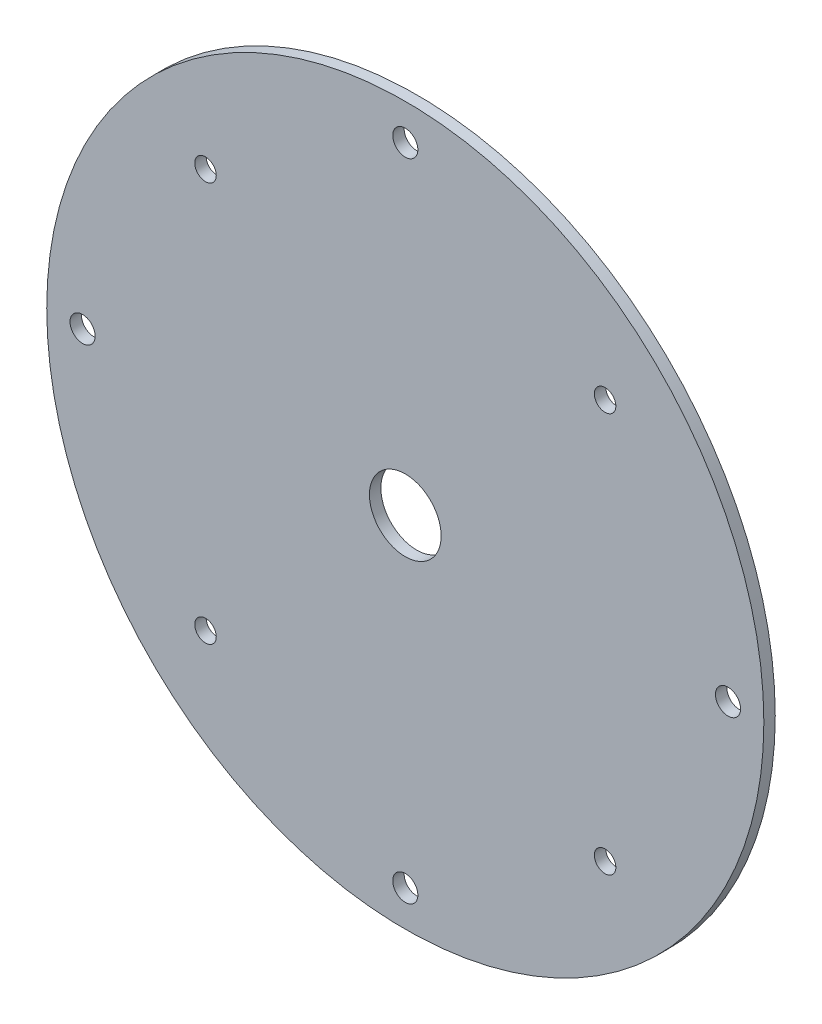
from build123d import *

# Parameters (mm, degrees)
SKETCH1_R           = 50
SKETCH1_R_2         = 5
BOSS_EXTRUDE1_DEPTH = 1.59
SKETCH2_R           = 1.75
CUT_EXTRUDE1_DEPTH  = 1.59
SKETCH3_R           = 1.5
CUT_EXTRUDE2_DEPTH  = 10


with BuildPart() as part:
    # Sketch1 → Boss-Extrude1 (new body)
    with BuildSketch(Plane.XY):
        with Locations(Location((0, 0, 0), (0, 0, 180))):
            Circle(SKETCH1_R)
        with Locations(Location((0, 0, 0), (0, 0, 180))):
            Circle(SKETCH1_R_2, mode=Mode.SUBTRACT)
    extrude(amount=BOSS_EXTRUDE1_DEPTH)

    # Sketch2 → Cut-Extrude1 (cut)
    with BuildSketch(Plane.XY.offset(1.59)):
        with Locations((0, 45)):
            Circle(SKETCH2_R)
        with Locations((45, 0)):
            Circle(SKETCH2_R)
        with Locations((0, -45)):
            Circle(SKETCH2_R)
        with Locations((-45, 0)):
            Circle(SKETCH2_R)
    extrude(amount=-CUT_EXTRUDE1_DEPTH, mode=Mode.SUBTRACT)

    # Sketch3 → Cut-Extrude2 (cut)
    with BuildSketch(Plane.XY.offset(1.59)):
        with Locations((-27.86, 27.860014357)):
            Circle(SKETCH3_R)
        with Locations((27.860014357, 27.86)):
            Circle(SKETCH3_R)
        with Locations((27.86, -27.860014357)):
            Circle(SKETCH3_R)
        with Locations((-27.860014357, -27.86)):
            Circle(SKETCH3_R)
    extrude(amount=-CUT_EXTRUDE2_DEPTH, mode=Mode.SUBTRACT)


solid = part.part
